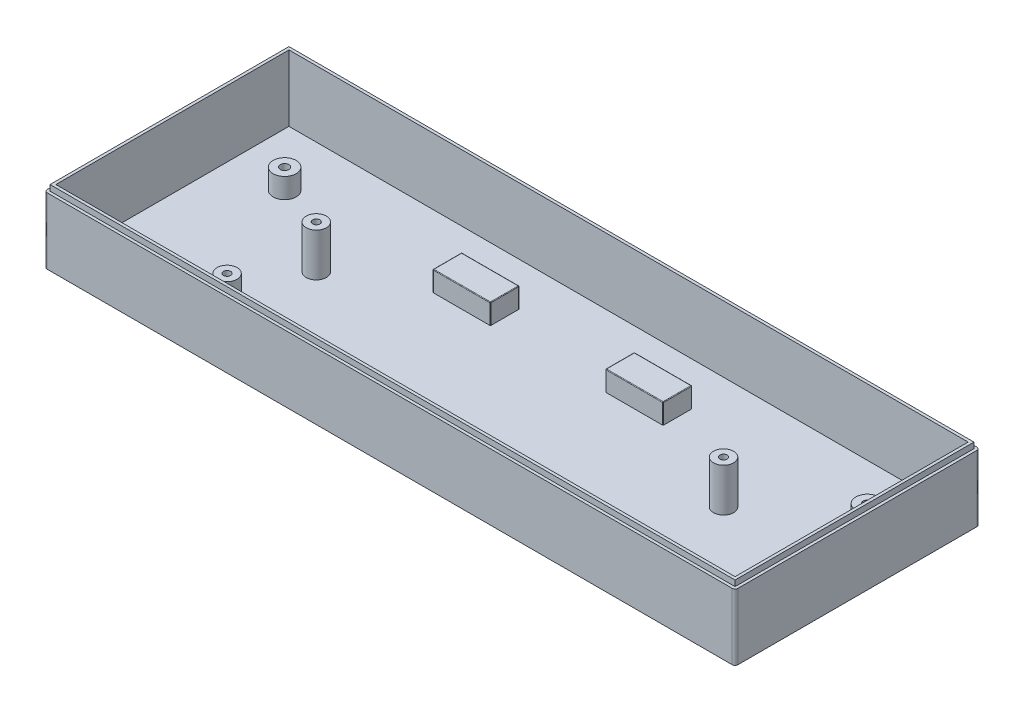
from build123d import *

# Parameters (mm, degrees)
SKETCH1_W           = 240
SKETCH1_H           = 85
BOSS_EXTRUDE1_DEPTH = 25
SKETCH2_W           = 236
SKETCH2_H           = 81
CUT_EXTRUDE1_DEPTH  = 23
SKETCH3_W           = 240
SKETCH3_H           = 85
SKETCH3_W_2         = 238
SKETCH3_H_2         = 83
CUT_EXTRUDE2_DEPTH  = 2
SKETCH5_R           = 4
SKETCH5_W           = 20
SKETCH5_H           = 10
BOSS_EXTRUDE2_DEPTH = 7
SKETCH6_R           = 1.5
CUT_EXTRUDE3_DEPTH  = 5
SKETCH7_R           = 3.5
BOSS_EXTRUDE3_DEPTH = 15
SKETCH8_R           = 1.25
CUT_EXTRUDE4_DEPTH  = 7
FILLET1_R           = 0.2
FILLET2_R           = 1


with BuildPart() as part:
    # Sketch1 → Boss-Extrude1 (new body)
    with BuildSketch(Plane(origin=(0, 0, 0), x_dir=(1, 0, 0), z_dir=(0, 1, 0))):
        Rectangle(SKETCH1_W, SKETCH1_H)
    extrude(amount=BOSS_EXTRUDE1_DEPTH)

    # Sketch2 → Cut-Extrude1 (cut)
    with BuildSketch(Plane(origin=(0, 25, 0), x_dir=(1, 0, 0), z_dir=(0, 1, 0))):
        Rectangle(SKETCH2_W, SKETCH2_H)
    extrude(amount=-CUT_EXTRUDE1_DEPTH, mode=Mode.SUBTRACT)

    # Sketch3 → Cut-Extrude2 (cut)
    with BuildSketch(Plane(origin=(0, 25, 0), x_dir=(1, 0, 0), z_dir=(0, 1, 0))):
        Rectangle(SKETCH3_W, SKETCH3_H)
        Rectangle(SKETCH3_W_2, SKETCH3_H_2, mode=Mode.SUBTRACT)
    extrude(amount=-CUT_EXTRUDE2_DEPTH, mode=Mode.SUBTRACT)

    # Sketch5 → Boss-Extrude2 (add)
    with BuildSketch(Plane(origin=(0, 2, 0), x_dir=(1, 0, 0), z_dir=(0, 1, 0))):
        with Locations(Location((-99.5, 20.5, 0), (0, 0, 270))):
            Circle(SKETCH5_R)
        with Locations(Location((103, 20.5, 0), (0, 0, 270))):
            Circle(SKETCH5_R)
        with Locations((-33, 20.5)):
            Rectangle(SKETCH5_W, SKETCH5_H)
        with Locations((27, 20.5)):
            Rectangle(SKETCH5_W, SKETCH5_H)
    extrude(amount=BOSS_EXTRUDE2_DEPTH)

    # Sketch6 → Cut-Extrude3 (cut)
    with BuildSketch(Plane(origin=(0, 9, 0), x_dir=(1, 0, 0), z_dir=(0, 1, 0))):
        with Locations(Location((-99.5, 20.5, 0), (0, 0, 270))):
            Circle(SKETCH6_R)
        with Locations(Location((103, 20.5, 0), (0, 0, 270))):
            Circle(SKETCH6_R)
    extrude(amount=-CUT_EXTRUDE3_DEPTH, mode=Mode.SUBTRACT)

    # Sketch7 → Boss-Extrude3 (add)
    with BuildSketch(Plane(origin=(0, 2, 0), x_dir=(1, 0, 0), z_dir=(0, 1, 0))):
        with Locations(Location((72, 1.5, 0), (0, 0, 270))):
            Circle(SKETCH7_R)
        with Locations(Location((-69.5, -29.5, 0), (0, 0, 270))):
            Circle(SKETCH7_R)
        with Locations(Location((-69.5, 1.5, 0), (0, 0, 270))):
            Circle(SKETCH7_R)
    extrude(amount=BOSS_EXTRUDE3_DEPTH)

    # Sketch8 → Cut-Extrude4 (cut)
    with BuildSketch(Plane(origin=(0, 17, 0), x_dir=(1, 0, 0), z_dir=(0, 1, 0))):
        with Locations(Location((72, 1.5, 0), (0, 0, 270))):
            Circle(SKETCH8_R)
        with Locations(Location((-69.5, -29.5, 0), (0, 0, 270))):
            Circle(SKETCH8_R)
        with Locations(Location((-69.5, 1.5, 0), (0, 0, 270))):
            Circle(SKETCH8_R)
    extrude(amount=-CUT_EXTRUDE4_DEPTH, mode=Mode.SUBTRACT)

    # Fillet1
    fillet1_edges = [part.edges().sort_by_distance(p)[0] for p in [
        (-23, 5.5, -15.5),
        (-23, 5.5, -25.5),
        (-43, 5.5, -25.5),
        (-43, 5.5, -15.5),
        (-23, 9, -20.5),
        (-33, 9, -25.5),
        (-43, 9, -20.5),
        (-33, 9, -15.5),
        (37, 5.5, -15.5),
        (37, 5.5, -25.5),
        (17, 5.5, -25.5),
        (17, 5.5, -15.5),
        (37, 9, -20.5),
        (27, 9, -25.5),
        (17, 9, -20.5),
        (27, 9, -15.5),
    ]]
    fillet(fillet1_edges, radius=FILLET1_R)

    # Fillet2
    fillet2_edges = [part.edges().sort_by_distance(p)[0] for p in [
        (120, 11.5, 42.5),
        (-120, 11.5, 42.5),
        (-120, 11.5, -42.5),
        (120, 11.5, -42.5),
    ]]
    fillet(fillet2_edges, radius=FILLET2_R)


solid = part.part
